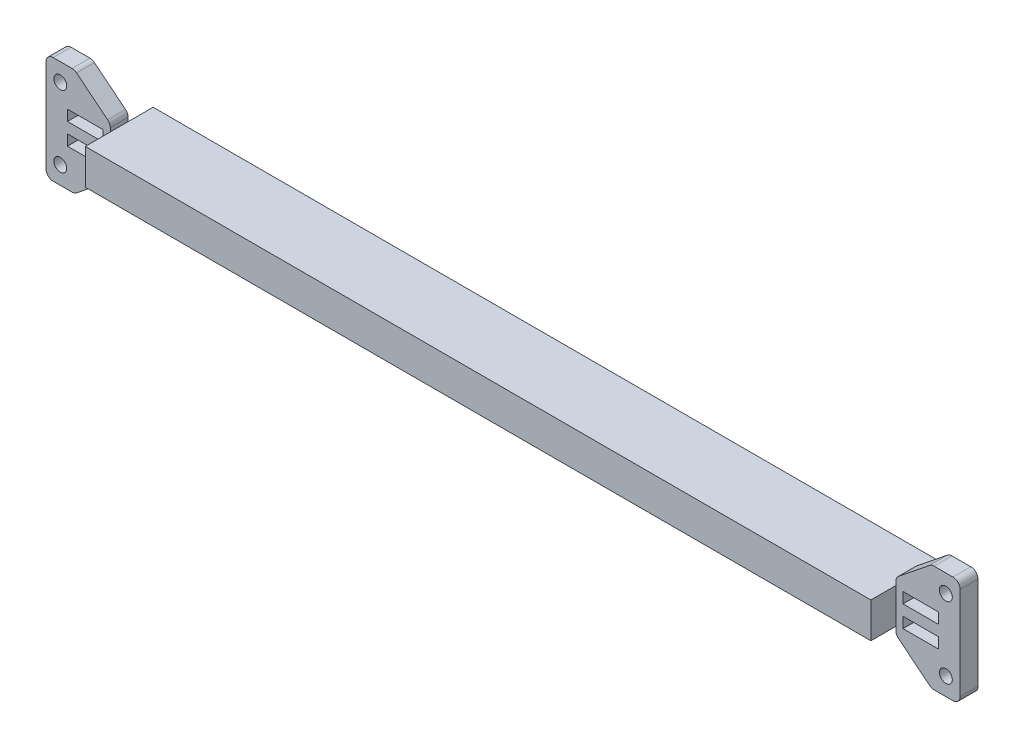
from build123d import *

# Parameters (mm, degrees)
SKETCH1_R           = 2.286
SKETCH1_W           = 12.7
SKETCH1_H           = 3.81
BOSS_EXTRUDE1_DEPTH = 3.175
FILLET1_R           = 2.54
SKETCH3_W           = 279.4
SKETCH3_H           = 12.573
BOSS_EXTRUDE3_DEPTH = 8.89


with BuildPart() as part:
    # Sketch1 → Boss-Extrude1 (new, symmetric)
    with BuildSketch(Plane.XY):
        Polygon((-139.7, -6.2865), (139.7, -6.2865), (139.7, -8.8265), (152.4, -19.05), (162.56, -19.05), (162.56, 19.05), (152.4, 19.05), (139.7, 8.8265), (139.7, 6.2865), (-139.7, 6.2865), (-139.7, 8.8265), (-152.4, 19.05), (-162.56, 19.05), (-162.56, -19.05), (-152.4, -19.05), (-139.7, -8.8265), align=None)
        with Locations((-157.48, -12.7)):
            Circle(SKETCH1_R, mode=Mode.SUBTRACT)
        with Locations(Location((-157.48, 12.7, 0), (0, 0, 180))):
            Circle(SKETCH1_R, mode=Mode.SUBTRACT)
        with Locations((157.48, 12.7)):
            Circle(SKETCH1_R, mode=Mode.SUBTRACT)
        with Locations(Location((157.48, -12.7, 0), (0, 0, 180))):
            Circle(SKETCH1_R, mode=Mode.SUBTRACT)
        with Locations((-148.59, 3.81)):
            Rectangle(SKETCH1_W, SKETCH1_H, mode=Mode.SUBTRACT)
        with Locations((-148.59, -3.81)):
            Rectangle(SKETCH1_W, SKETCH1_H, mode=Mode.SUBTRACT)
        with Locations((148.59, -3.81)):
            Rectangle(SKETCH1_W, SKETCH1_H, mode=Mode.SUBTRACT)
        with Locations((148.59, 3.81)):
            Rectangle(SKETCH1_W, SKETCH1_H, mode=Mode.SUBTRACT)
    extrude(amount=BOSS_EXTRUDE1_DEPTH, both=True)

    # Fillet1
    fillet1_edges = [part.edges().sort_by_distance(p)[0] for p in [
        (-139.7, -8.8265, 0),
        (-152.4, -19.05, 0),
        (-162.56, -19.05, 0),
        (-162.56, 19.05, 0),
        (-152.4, 19.05, 0),
        (-139.7, 8.8265, 0),
        (139.7, 8.8265, 0),
        (152.4, 19.05, 0),
        (162.56, 19.05, 0),
        (162.56, -19.05, 0),
        (152.4, -19.05, 0),
        (139.7, -8.8265, 0),
    ]]
    fillet(fillet1_edges, radius=FILLET1_R)

    # Sketch3 → Boss-Extrude3 (add)
    with BuildSketch(Plane.XY.offset(3.175)):
        Rectangle(SKETCH3_W, SKETCH3_H)
    boss_extrude3 = extrude(amount=BOSS_EXTRUDE3_DEPTH)

    # Mirror1: Boss-Extrude3 across plane
    add(boss_extrude3.mirror(Plane.XY))


solid = part.part
